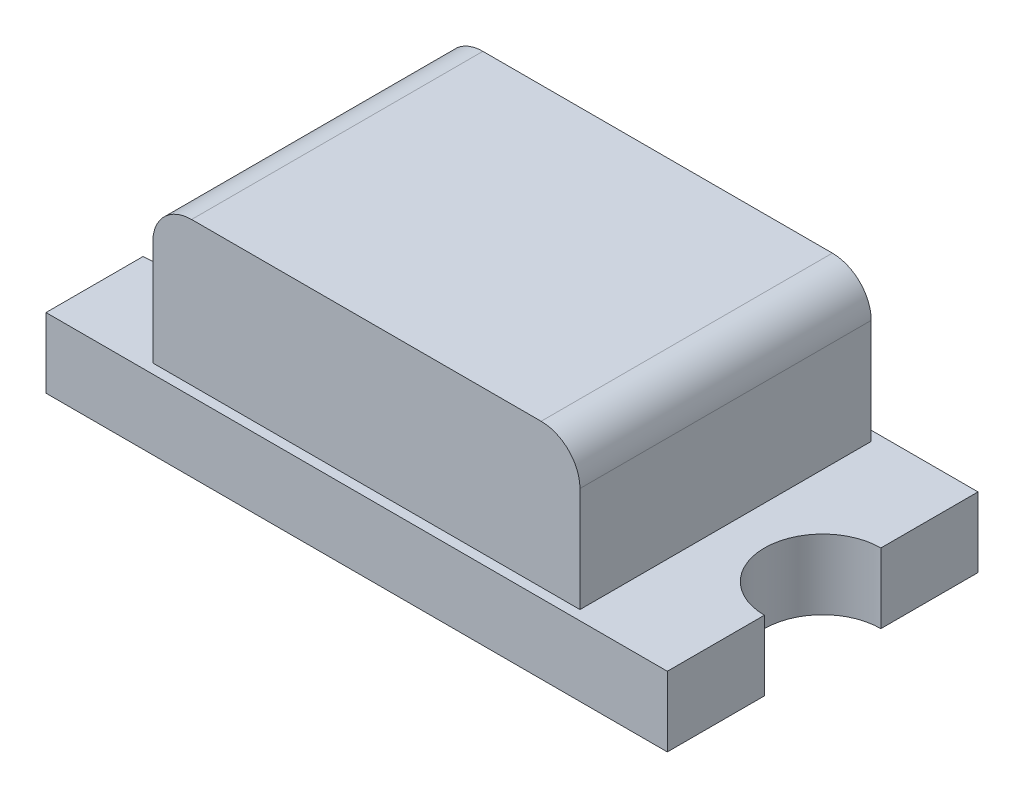
from build123d import *

# Parameters (mm, degrees)
SKETCH1_W           = 1.6
SKETCH1_H           = 0.8
BOSS_EXTRUDE1_DEPTH = 0.18
CUT_EXTRUDE1_DEPTH  = 0.18
SKETCH3_W           = 1.1
SKETCH3_H           = 0.75
BOSS_EXTRUDE2_DEPTH = 0.37
FILLET1_R           = 0.1


with BuildPart() as part:
    # Sketch1 → Boss-Extrude1 (new body)
    with BuildSketch(Plane(origin=(0, 0, 0), x_dir=(1, 0, 0), z_dir=(0, 1, 0))):
        Rectangle(SKETCH1_W, SKETCH1_H)
    extrude(amount=BOSS_EXTRUDE1_DEPTH)

    # Sketch2 → Cut-Extrude1 (cut)
    with BuildSketch(Plane(origin=(0, 0.18, 0), x_dir=(1, 0, 0), z_dir=(0, 1, 0))):
        with BuildLine():
            Line((-0.8, -0.15), (-0.8, 0.15))
            ThreePointArc((-0.8, 0.15), (-0.65, 0), (-0.8, -0.15))
        make_face()
    cut_extrude1 = extrude(amount=-CUT_EXTRUDE1_DEPTH, mode=Mode.SUBTRACT)

    # Mirror1: Cut-Extrude1 across plane
    add(cut_extrude1.mirror(Plane(origin=(0, 0, 0), x_dir=(0, 0, 1), z_dir=(1, 0, 0))), mode=Mode.SUBTRACT)

    # Sketch3 → Boss-Extrude2 (add)
    with BuildSketch(Plane(origin=(0, 0.18, 0), x_dir=(1, 0, 0), z_dir=(0, 1, 0))):
        Rectangle(SKETCH3_W, SKETCH3_H)
    extrude(amount=BOSS_EXTRUDE2_DEPTH)

    # Fillet1
    fillet1_edges = [part.edges().sort_by_distance(p)[0] for p in [
        (0.55, 0.55, 0),
        (-0.55, 0.55, 0),
    ]]
    fillet(fillet1_edges, radius=FILLET1_R)


solid = part.part
